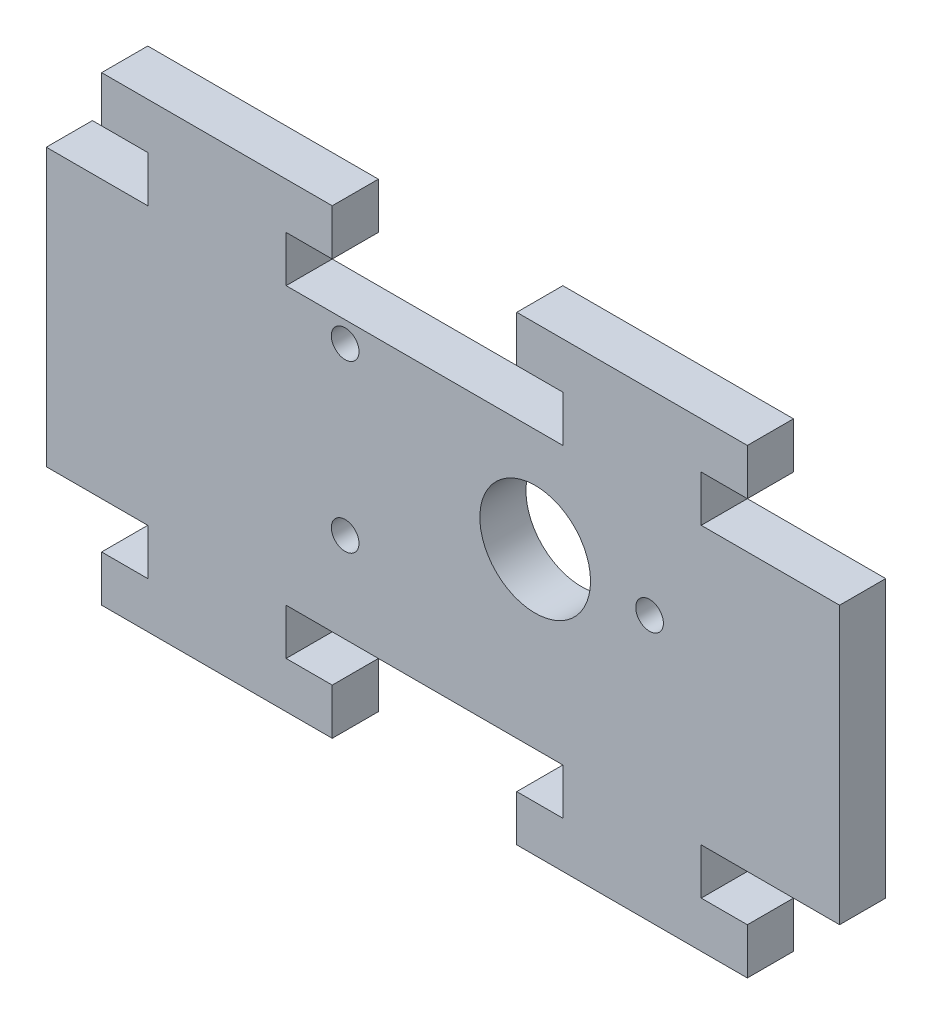
from build123d import *

# Parameters (mm, degrees)
SKETCH1_R           = 1.5
SKETCH1_R_2         = 6
BOSS_EXTRUDE1_DEPTH = 5


with BuildPart() as part:
    # Sketch1 → Boss-Extrude1 (new body)
    with BuildSketch(Plane.XY):
        Polygon((11, 27.5), (6, 27.5), (6, 32.5), (31, 32.5), (31, 27.5), (26, 27.5), (26, 22.5), (56, 22.5), (56, 27.5), (51, 27.5), (51, 32.5), (56, 32.5), (71, 32.5), (76, 32.5), (76, 27.5), (71, 27.5), (71, 22.5), (86, 22.5), (86, -7.5), (71, -7.5), (71, -12.5), (76, -12.5), (76, -17.5), (71, -17.5), (56, -17.5), (51, -17.5), (51, -12.5), (56, -12.5), (56, -7.5), (26, -7.5), (26, -12.5), (31, -12.5), (31, -17.5), (26, -17.5), (11, -17.5), (6, -17.5), (6, -12.5), (11, -12.5), (11, -7.5), (0, -7.5), (0, 22.5), (11, 22.5), align=None)
        with Locations((32.4, 20.25)):
            Circle(SKETCH1_R, mode=Mode.SUBTRACT)
        with Locations((32.4, 2.25)):
            Circle(SKETCH1_R, mode=Mode.SUBTRACT)
        with Locations((53, 11.25)):
            Circle(SKETCH1_R_2, mode=Mode.SUBTRACT)
        with Locations((65.4, 11.25)):
            Circle(SKETCH1_R, mode=Mode.SUBTRACT)
    extrude(amount=BOSS_EXTRUDE1_DEPTH)


solid = part.part
